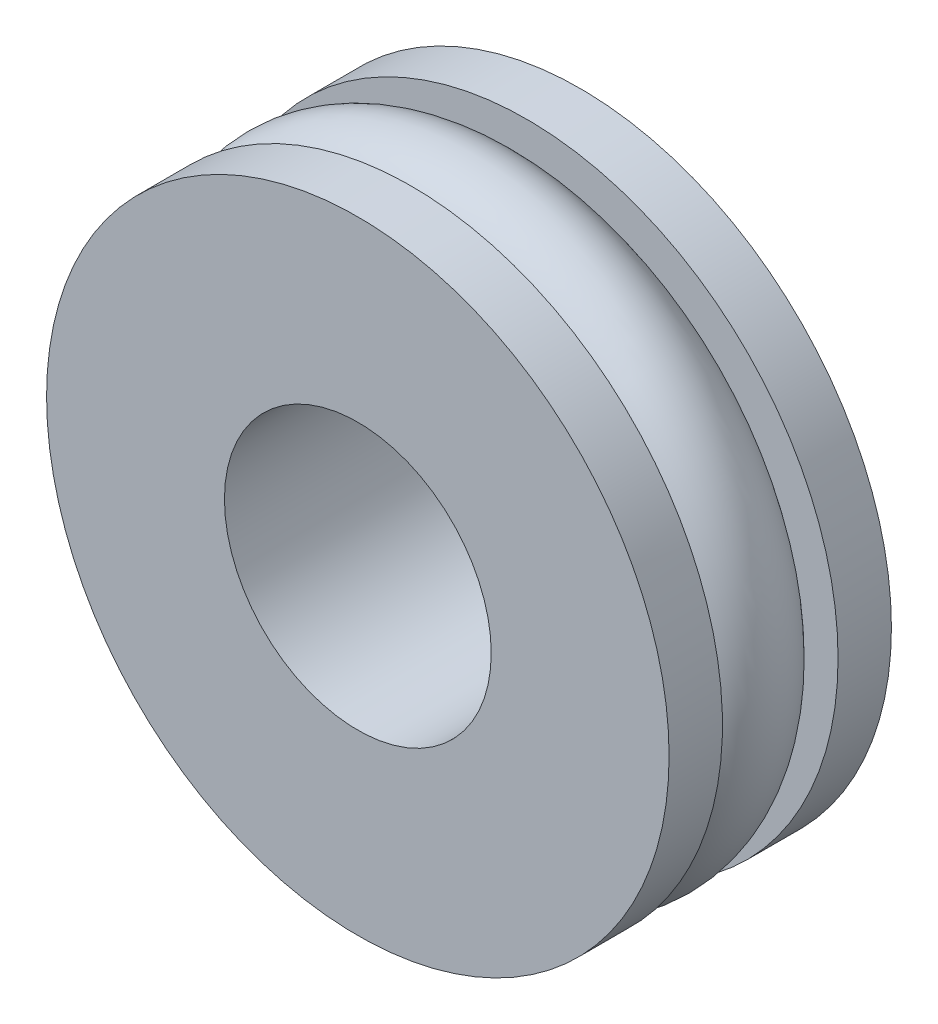
from build123d import *
from build123d.topology import SkipClean

# Parameters (mm, degrees)
SKETCH_1_R      = 7
SKETCH_1_R_2    = 3
EXTRUDE_1_DEPTH = 5


with BuildPart() as part:
    # 草图1 → 凸台-拉伸1 (new body)
    with BuildSketch(Plane.XY):
        Circle(SKETCH_1_R)
        Circle(SKETCH_1_R_2, mode=Mode.SUBTRACT)
    extrude(amount=EXTRUDE_1_DEPTH)

    # 草图2 → 切除-旋转1 (revolve, cut)
    with SkipClean():  # the faces are left unmerged after this step: merging them gives an invalid solid
        with BuildSketch(Plane(origin=(0, 0, 0), x_dir=(1, 0, 0), z_dir=(0, 1, 0)), mode=Mode.PRIVATE) as cut_revolve_1_sk:
            with BuildLine():
                Line((5.7, -1.2), (7.909662878, -1.2))
                Line((7.909662878, -1.2), (7.909662878, -3.8))
                Line((7.909662878, -3.8), (5.7, -3.8))
                ThreePointArc((5.7, -3.8), (7, -2.5), (5.7, -1.2))
            make_face()
        revolve(cut_revolve_1_sk.sketch.rotate(Axis((0, 0, 0), (0, 0, -1)), 180), axis=Axis((0, 0, 0), (0, 0, -1)), mode=Mode.SUBTRACT)


solid = part.part
